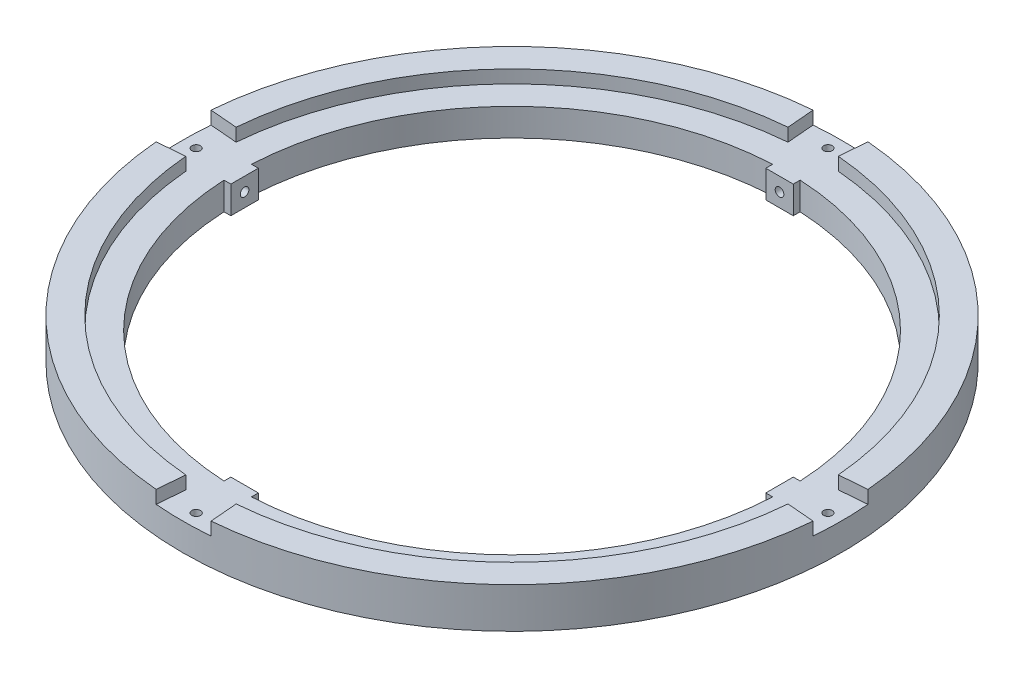
from build123d import *

# Parameters (mm, degrees)
SKETCH1_R           = 152.4
SKETCH1_R_2         = 139.7
BOSS_EXTRUDE1_DEPTH = 18.7
SKETCH1_3_R         = 139.7
SKETCH1_3_R_2       = 127
BOSS_EXTRUDE2_DEPTH = 12.7
BOSS_EXTRUDE3_DEPTH = 12.7
SKETCH3_R           = 2
CUT_EXTRUDE1_DEPTH  = 25.4
CIRPATTERN1_COUNT   = 4
CUT_EXTRUDE4_START  = -6
CUT_EXTRUDE4_DEPTH  = 6
SKETCH5_R           = 2
CUT_EXTRUDE5_DEPTH  = 12.7
CIRPATTERN2_COUNT   = 4


with BuildPart() as part:
    # Sketch1 → Boss-Extrude1 (new body)
    with BuildSketch(Plane(origin=(0, 0, 0), x_dir=(1, 0, 0), z_dir=(0, 1, 0))):
        Circle(SKETCH1_R)
        Circle(SKETCH1_R_2, mode=Mode.SUBTRACT)
    extrude(amount=BOSS_EXTRUDE1_DEPTH)

    # Sketch1<3> → Boss-Extrude2 (add)
    with BuildSketch(Plane(origin=(0, 0, 0), x_dir=(1, 0, 0), z_dir=(0, 1, 0))):
        Circle(SKETCH1_3_R)
        Circle(SKETCH1_3_R_2, mode=Mode.SUBTRACT)
    extrude(amount=BOSS_EXTRUDE2_DEPTH)

    # Sketch2 → Boss-Extrude3 (add)
    with BuildSketch(Plane.XZ):
        with BuildLine():
            ThreePointArc((-6.35, -126.841150657), (0, -127), (6.35, -126.841150657))
            Line((6.35, -126.841150657), (6.35, -123.666150657))
            Line((6.35, -123.666150657), (-6.35, -123.666150657))
            Line((-6.35, -123.666150657), (-6.35, -126.841150657))
        make_face()
        with BuildLine():
            ThreePointArc((-126.841150657, 6.35), (-127, 0), (-126.841150657, -6.35))
            Line((-126.841150657, -6.35), (-123.666150657, -6.35))
            Line((-123.666150657, -6.35), (-123.666150657, 6.35))
            Line((-123.666150657, 6.35), (-126.841150657, 6.35))
        make_face()
        with BuildLine():
            Line((123.666150657, -6.35), (126.841150657, -6.35))
            ThreePointArc((126.841150657, -6.35), (127, 0), (126.841150657, 6.35))
            Line((126.841150657, 6.35), (123.666150657, 6.35))
            Line((123.666150657, 6.35), (123.666150657, -6.35))
        make_face()
        with BuildLine():
            ThreePointArc((6.35, 126.841150657), (0, 127), (-6.35, 126.841150657))
            Line((-6.35, 126.841150657), (-6.35, 123.666150657))
            Line((-6.35, 123.666150657), (6.35, 123.666150657))
            Line((6.35, 123.666150657), (6.35, 126.841150657))
        make_face()
    extrude(amount=-BOSS_EXTRUDE3_DEPTH)

    # Sketch3 → Cut-Extrude1 (cut)
    with BuildSketch(Plane(origin=(-123.666150657, 0, 0), x_dir=(0, 0, -1), z_dir=(1, 0, 0))):
        with Locations((0, 6.35)):
            Circle(SKETCH3_R)
    cut_extrude1 = extrude(amount=-CUT_EXTRUDE1_DEPTH, mode=Mode.SUBTRACT)

    # CirPattern1: Cut-Extrude1 ×4 about axis
    cirpattern1_axis = Axis((0, 12.7, 0), (0, 1, 0))
    for i in range(1, CIRPATTERN1_COUNT):
        add(cut_extrude1.rotate(cirpattern1_axis, i * 360 / CIRPATTERN1_COUNT), mode=Mode.SUBTRACT)

    # Sketch4 → Cut-Extrude4 (cut)
    with BuildSketch(Plane(origin=(0, 18.7, 0), x_dir=(1, 0, 0), z_dir=(0, 1, 0)).offset(CUT_EXTRUDE4_START)):
        with BuildLine():
            ThreePointArc((-139.214085484, -11.641666667), (-139.699999908, -0.00507263), (-139.214930556, 11.631556663))
            Line((-139.214930556, 11.631556663), (-151.870833333, 12.688970905))
            ThreePointArc((-151.870833333, 12.688970905), (-152.3999999, -0.005533779), (-151.869911437, -12.7))
            Line((-151.869911437, -12.7), (-139.214085484, -11.641666667))
        make_face()
    cut_extrude4 = extrude(amount=CUT_EXTRUDE4_DEPTH, mode=Mode.SUBTRACT)

    # Sketch5 → Cut-Extrude5 (cut)
    with BuildSketch(Plane(origin=(0, 12.7, 0), x_dir=(1, 0, 0), z_dir=(0, 1, 0))):
        with Locations((-146.0499999, -0.005533779)):
            Circle(SKETCH5_R)
    cut_extrude5 = extrude(amount=-CUT_EXTRUDE5_DEPTH, mode=Mode.SUBTRACT)

    # CirPattern2: Cut-Extrude4, Cut-Extrude5 ×4 about axis
    cirpattern2_axis = Axis((0, 18.7, 0), (0, 1, 0))
    add([cut_extrude4.rotate(cirpattern2_axis, i * 360 / CIRPATTERN2_COUNT) for i in range(1, CIRPATTERN2_COUNT)], mode=Mode.SUBTRACT)
    add([cut_extrude5.rotate(cirpattern2_axis, i * 360 / CIRPATTERN2_COUNT) for i in range(1, CIRPATTERN2_COUNT)], mode=Mode.SUBTRACT)


solid = part.part
